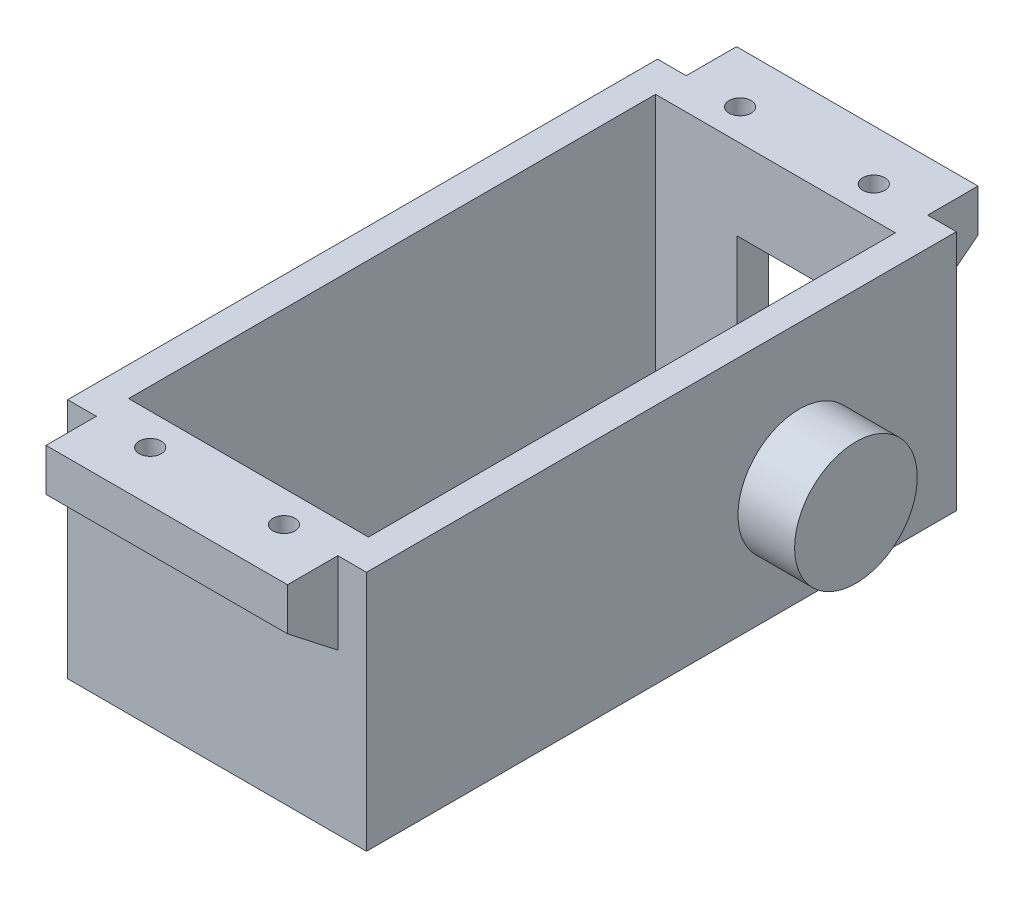
from build123d import *

# Parameters (mm, degrees)
SKETCH_1_W          = 38
SKETCH_1_H          = 75
EXTRUDE_1_DEPTH     = 30.73
SKETCH_2_R          = 7.8
EXTRUDE_2_DEPTH     = 7.2
SKETCH_3_W          = 30.7
SKETCH_3_H          = 10.4
EXTRUDE_3_DEPTH     = 6.4
SKETCH_5_W          = 30.5
SKETCH_5_H          = 67
CUT_EXTRUDE_1_DEPTH = 60.648829829
CUT_EXTRUDE_2_REACH = 87.181
SKETCH_6_W          = 9.8
SKETCH_6_H          = 20.33
CUT_EXTRUDE_3_REACH = 69.808
SKETCH_8_R          = 1.4
CUT_EXTRUDE_4_DEPTH = 7.4


with BuildPart() as part:
    # 草图1 → 凸台-拉伸1 (new body)
    with BuildSketch(Plane(origin=(0, 0, 0), x_dir=(1, 0, 0), z_dir=(0, 1, 0))):
        Rectangle(SKETCH_1_W, SKETCH_1_H)
    extrude(amount=EXTRUDE_1_DEPTH)

    # 草图2 → 凸台-拉伸2 (add)
    with BuildSketch(Plane.ZY.offset(19)):
        with Locations(Location((-17.53, 13.39, 0), (0, 0, 180))):
            Circle(SKETCH_2_R)
    extrude_2 = extrude(amount=EXTRUDE_2_DEPTH)

    # 草图3 → 凸台-拉伸3 (add)
    with BuildSketch(Plane(origin=(0, 0, -37.5), x_dir=(-1, 0, 0), z_dir=(0, 0, -1))):
        with Locations((0, 25.53)):
            Rectangle(SKETCH_3_W, SKETCH_3_H)
    extrude_3 = extrude(amount=EXTRUDE_3_DEPTH)

    # 草图5 → 切除-拉伸1 (cut, through all)
    with BuildSketch(Plane(origin=(0, 30.73, 0), x_dir=(1, 0, 0), z_dir=(0, 1, 0))):
        Rectangle(SKETCH_5_W, SKETCH_5_H)
    extrude(amount=-CUT_EXTRUDE_1_DEPTH, mode=Mode.SUBTRACT)

    # 镜向2: 凸台-拉伸2 across plane
    add(extrude_2.mirror(Plane(origin=(0, 0, 0), x_dir=(0, 0, 1), z_dir=(1, 0, 0))))

    # 草图6 → 切除-拉伸2 (cut, up to next)
    with BuildSketch(Plane(origin=(0, 0, -37.5), x_dir=(-1, 0, 0), z_dir=(0, 0, -1)), mode=Mode.PRIVATE) as cut_extrude_2_sk1:
        with Locations((0, 10.165)):
            Rectangle(SKETCH_6_W, SKETCH_6_H)
    cut_extrude_2_tool1 = extrude(cut_extrude_2_sk1.sketch, amount=-CUT_EXTRUDE_2_REACH, mode=Mode.PRIVATE) & part.part
    add(cut_extrude_2_tool1.solids().sort_by_distance((0, 10.165, -37.5))[0], mode=Mode.SUBTRACT)

    # 草图7 → 切除-拉伸3 (cut, up to next)
    with BuildSketch(Plane(origin=(15.35, 0, 0), x_dir=(0, 0, -1), z_dir=(1, 0, 0)), mode=Mode.PRIVATE) as cut_extrude_3_sk1:
        Polygon((37.5, 20.33), (43.9, 25.33022801), (43.9, 20.33), align=None)
    cut_extrude_3_tool1 = extrude(cut_extrude_3_sk1.sketch, amount=-CUT_EXTRUDE_3_REACH, mode=Mode.PRIVATE) & part.part
    cut_extrude_3 = cut_extrude_3_tool1.solids().sort_by_distance((15.35, 21.996743, -41.766667))[0]
    add(cut_extrude_3, mode=Mode.SUBTRACT)

    # 镜向4: 凸台-拉伸3, 切除-拉伸3 across plane
    add(extrude_3.mirror(Plane.XY))
    add(cut_extrude_3.mirror(Plane.XY), mode=Mode.SUBTRACT)

    # 草图8 → 切除-拉伸4 (cut)
    with BuildSketch(Plane(origin=(0, 30.73, 0), x_dir=(1, 0, 0), z_dir=(0, 1, 0))):
        with Locations(Location((-8.5, 37.5, 0), (0, 0, 270))):
            Circle(SKETCH_8_R)
        with Locations(Location((8.5, 37.5, 0), (0, 0, 90))):
            Circle(SKETCH_8_R)
        with Locations(Location((8.5, -37.5, 0), (0, 0, 270))):
            Circle(SKETCH_8_R)
        with Locations(Location((-8.5, -37.5, 0), (0, 0, 90))):
            Circle(SKETCH_8_R)
    extrude(amount=-CUT_EXTRUDE_4_DEPTH, mode=Mode.SUBTRACT)


solid = part.part
